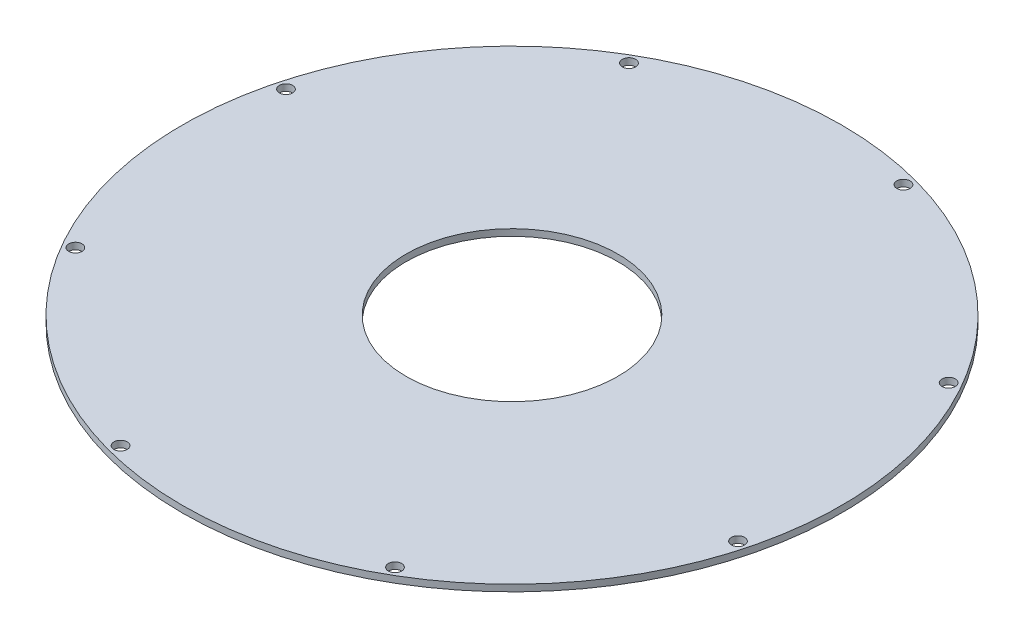
from build123d import *

# Parameters (mm, degrees)
SKETCH1_R                     = 99.5
SKETCH1_R_2                   = 32
BASE_DEPTH                    = 1
SKETCH2_R                     = 2
STRUCTURAL_HOLE_DEPTH         = 141.72846194
STRUCTURAL_HOLE_PATTERN_COUNT = 8


with BuildPart() as part:
    # Sketch1 → Base (new, symmetric)
    with BuildSketch(Plane(origin=(0, 0, 0), x_dir=(1, 0, 0), z_dir=(0, 1, 0))):
        with Locations(Location((0, 0, 0), (0, 0, 270))):
            Circle(SKETCH1_R)
        with Locations(Location((0, 0, 0), (0, 0, 270))):
            Circle(SKETCH1_R_2, mode=Mode.SUBTRACT)
    extrude(amount=BASE_DEPTH, both=True)

    # Sketch2 → Structural Hole (cut, through all)
    with BuildSketch(Plane(origin=(0, 1, 0), x_dir=(1, 0, 0), z_dir=(0, 1, 0))):
        with Locations(Location((24.976037852, 93.211842237, 0), (0, 0, 270))):
            Circle(SKETCH2_R)
    structural_hole = extrude(amount=-STRUCTURAL_HOLE_DEPTH, mode=Mode.SUBTRACT)

    # Structural Hole Pattern: Structural Hole ×8 about axis
    structural_hole_pattern_axis = Axis((0, 0, 0), (0, 1, 0))
    for i in range(1, STRUCTURAL_HOLE_PATTERN_COUNT):
        add(structural_hole.rotate(structural_hole_pattern_axis, i * 360 / STRUCTURAL_HOLE_PATTERN_COUNT), mode=Mode.SUBTRACT)


solid = part.part
